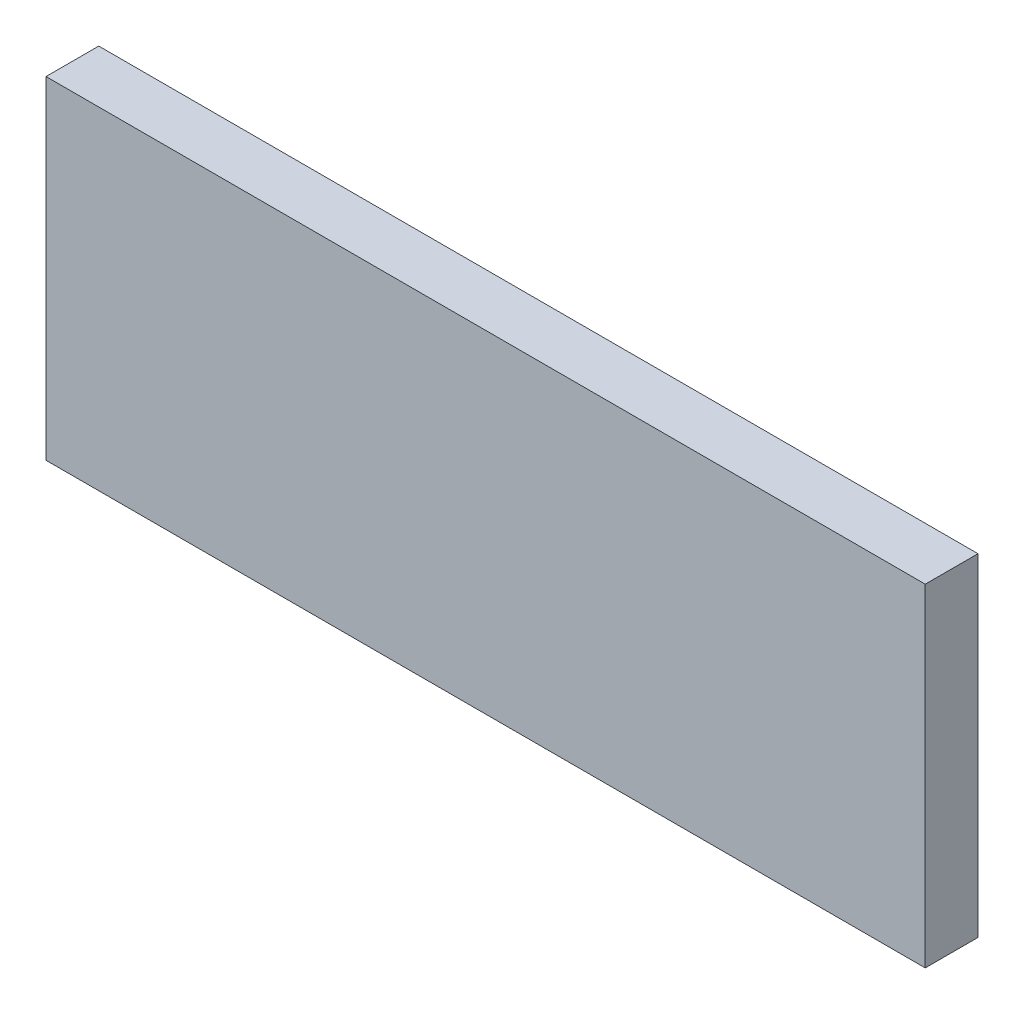
from build123d import *

# Parameters (mm, degrees)
SKETCH1_W           = 50
SKETCH1_H           = 18.9
BOSS_EXTRUDE1_DEPTH = 3


with BuildPart() as part:
    # Sketch1 → Boss-Extrude1 (new body)
    with BuildSketch(Plane.XY):
        Rectangle(SKETCH1_W, SKETCH1_H)
    extrude(amount=BOSS_EXTRUDE1_DEPTH)


solid = part.part
